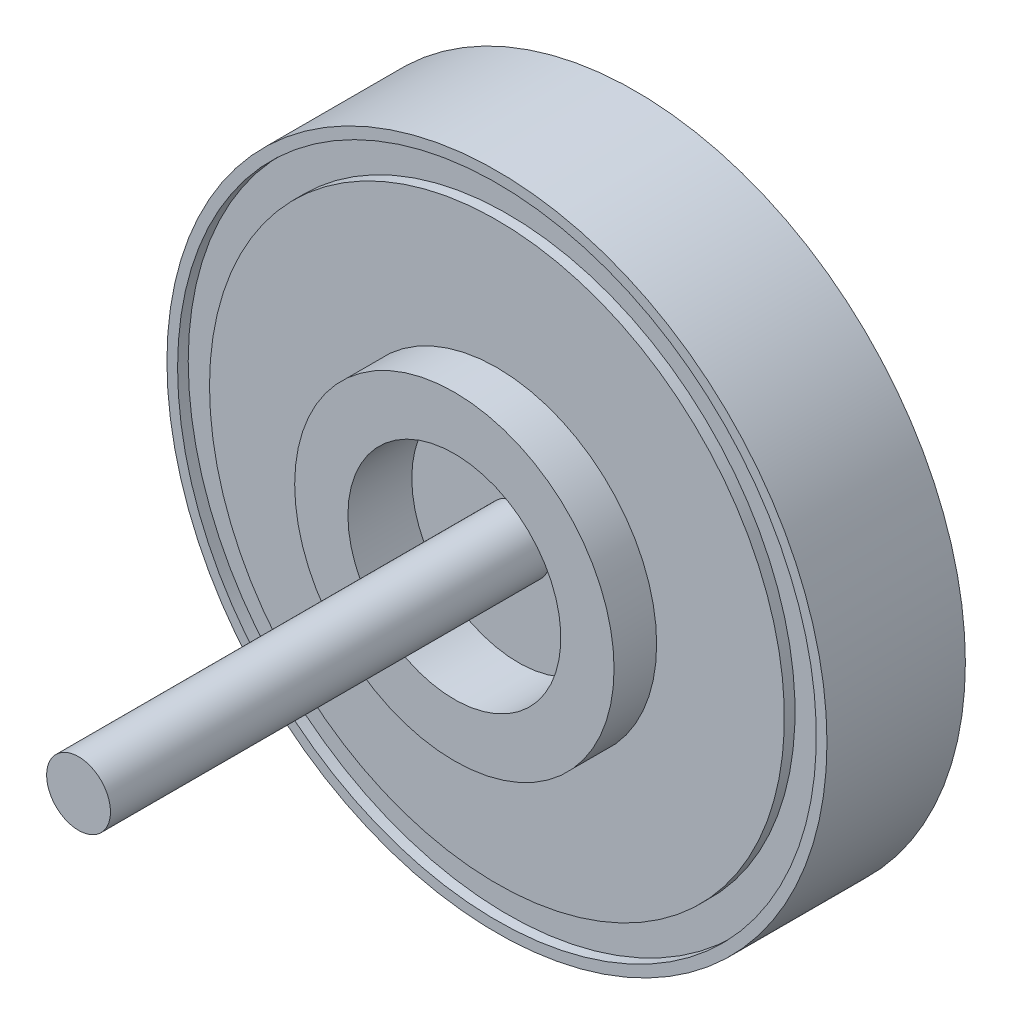
from build123d import *


with BuildPart() as part:
    # Croquis1 → Revolución1 (revolve)
    with BuildSketch(Plane(origin=(0, 0, 0), x_dir=(0, 0, -1), z_dir=(1, 0, 0)), mode=Mode.PRIVATE) as revoluci_n1_sk:
        Polygon((13.7, 0), (-41.3, 0), (-41.3, 3), (0, 3), (0, 10), (-6, 10), (-6, 15), (-2, 15), (-2, 27), (-1, 27), (-1, 30), (-2, 30), (-2, 31), (11, 31), (11, 29), (3, 29), (3, 22), (6, 22), (6, 14), (5, 14), (5, 9), (10, 9), (10, 3), (13.7, 3), align=None)
    revolve(revoluci_n1_sk.sketch.rotate(Axis((0, 0, -13.7), (0, 0, 1)), 90), axis=Axis((0, 0, -13.7), (0, 0, 1)))


solid = part.part
